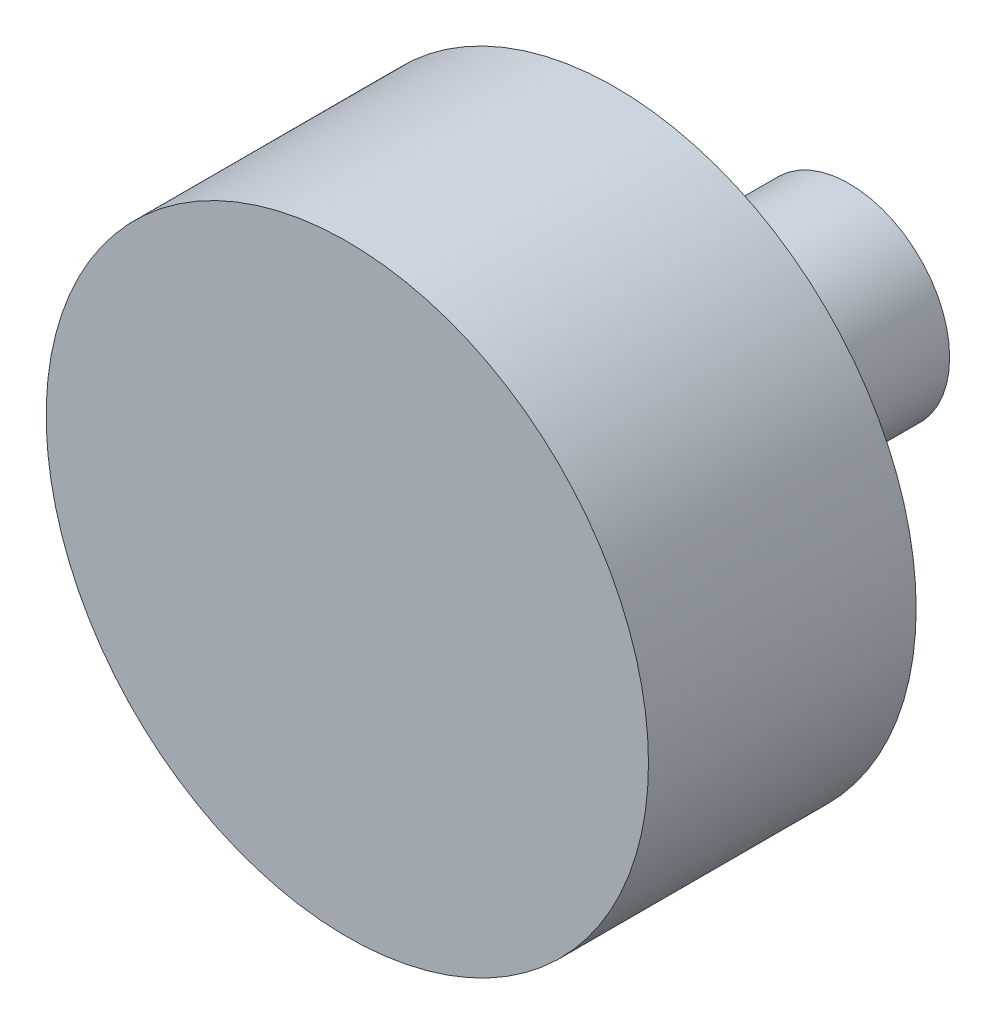
from build123d import *

# Parameters (mm, degrees)
RESSALTO_EXTRUS_O1_DEPTH      = 5
RESSALTO_EXTRUS_O1_DEPTH_BACK = 3
ESBO_O1_R                     = 9
ESBO_O2_R                     = 3
RESSALTO_EXTRUS_O2_DEPTH      = 10
ESBO_O3_R                     = 6
ESBO_O3_R_2                   = 3
CORTE_EXTRUS_O1_DEPTH         = 10


with BuildPart() as part:
    # Esboço1 → Ressalto-extrusão1 (new, two sides: drawn at the far end of the back side and taken through both)
    with BuildSketch(Plane.XY.offset(-RESSALTO_EXTRUS_O1_DEPTH_BACK)):
        Circle(ESBO_O1_R)
    extrude(amount=RESSALTO_EXTRUS_O1_DEPTH + RESSALTO_EXTRUS_O1_DEPTH_BACK)

    # Esboço2 → Ressalto-extrusão2 (add)
    with BuildSketch(Plane.XY):
        Circle(ESBO_O2_R)
    extrude(amount=-RESSALTO_EXTRUS_O2_DEPTH)

    # Esboço3 → Corte-extrusão1 (cut)
    with BuildSketch(Plane.XY):
        Circle(ESBO_O3_R)
        Circle(ESBO_O3_R_2, mode=Mode.SUBTRACT)
    extrude(amount=-CORTE_EXTRUS_O1_DEPTH, mode=Mode.SUBTRACT)


solid = part.part
